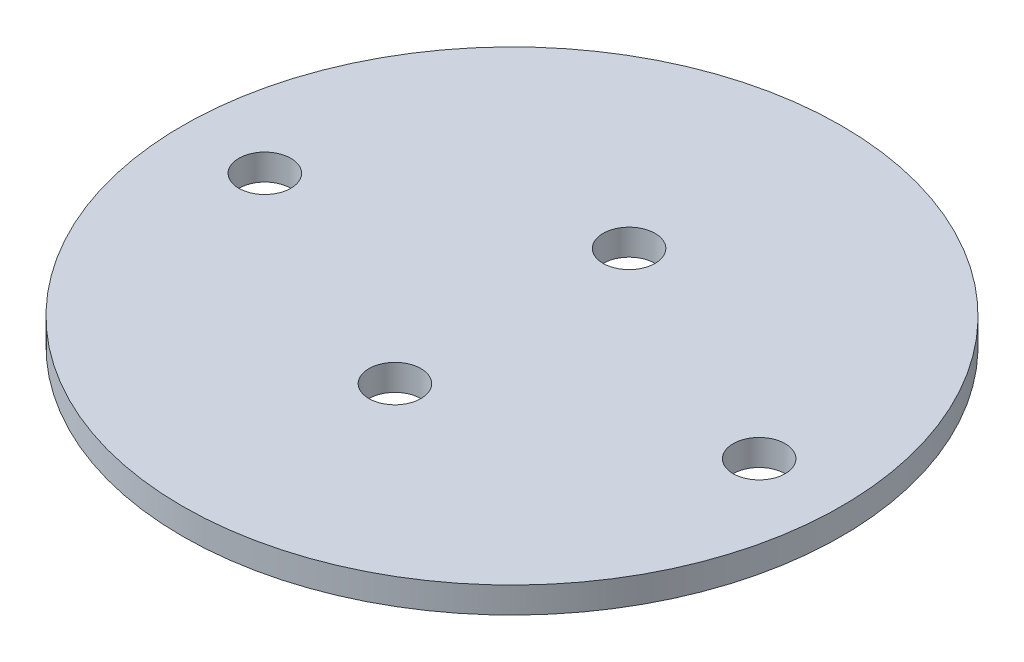
from build123d import *

# Parameters (mm, degrees)
SKETCH1_R           = 38
SKETCH1_R_2         = 3
BOSS_EXTRUDE1_DEPTH = 3


with BuildPart() as part:
    # Sketch1 → Boss-Extrude1 (new body)
    with BuildSketch(Plane(origin=(0, 0, 0), x_dir=(1, 0, 0), z_dir=(0, 1, 0))):
        with Locations(Location((0, 0, 0), (0, 0, 270))):
            Circle(SKETCH1_R)
        with Locations(Location((28.5, 0, 0), (0, 0, 270))):
            Circle(SKETCH1_R_2, mode=Mode.SUBTRACT)
        with Locations(Location((-28.5, 0, 0), (0, 0, 270))):
            Circle(SKETCH1_R_2, mode=Mode.SUBTRACT)
        with Locations(Location((0, 13.5, 0), (0, 0, 270))):
            Circle(SKETCH1_R_2, mode=Mode.SUBTRACT)
        with Locations(Location((0, -13.5, 0), (0, 0, 270))):
            Circle(SKETCH1_R_2, mode=Mode.SUBTRACT)
    extrude(amount=-BOSS_EXTRUDE1_DEPTH)


solid = part.part
